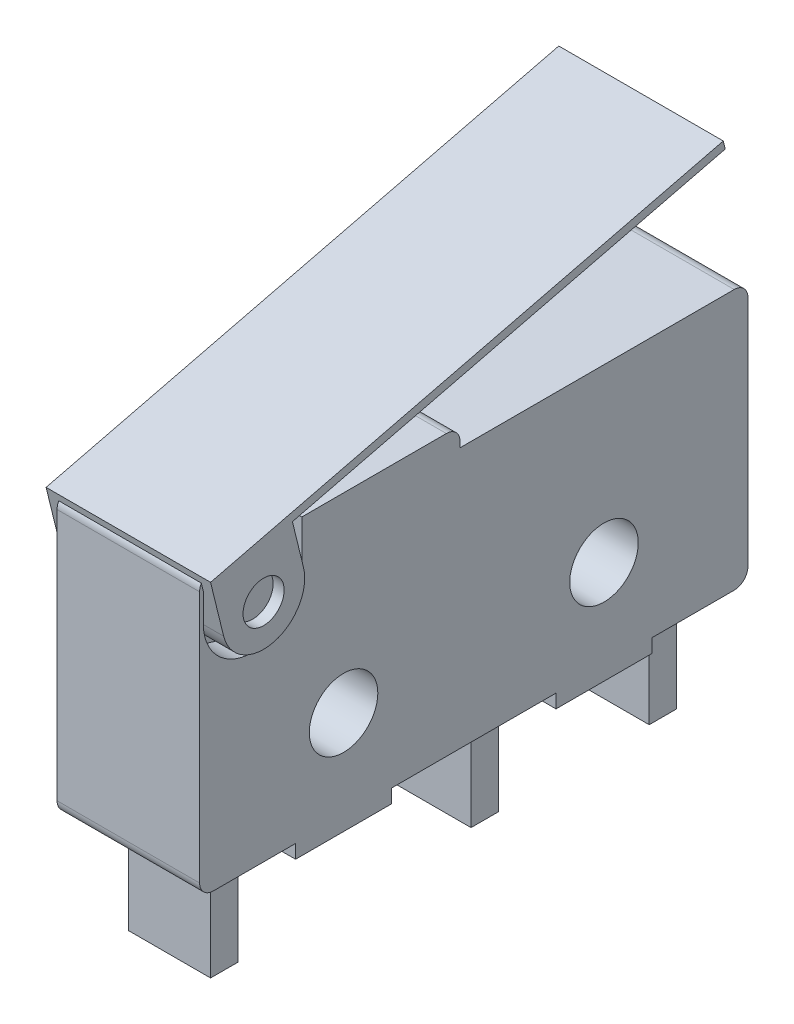
from build123d import *

# Parameters (mm, degrees)
SKETCH1_R             = 1.25
BOSS_EXTRUDE1_DEPTH   = 2.6
SKETCH2_W             = 1
SKETCH2_H             = 3.8
BOSS_EXTRUDE2_DEPTH   = 1.5
BOSS_EXTRUDE2_2_DEPTH = 1.5
BOSS_EXTRUDE2_3_DEPTH = 1.5
FILLET1_R             = 0.5
SKETCH3_R             = 0.75
BOSS_EXTRUDE3_DEPTH   = 3
SKETCH4_R             = 0.75
CUT_EXTRUDE1_DEPTH    = 1


with BuildPart() as part:
    # Sketch1 → Boss-Extrude1 (new, symmetric)
    with BuildSketch(Plane(origin=(0, 0, 0), x_dir=(0, 0, -1), z_dir=(1, 0, 0))):
        Polygon((9.5, 10.2), (9.5, 9.5), (20, 9.5), (20, 0), (16.5, 0), (16.5, -0.5), (13, -0.5), (13, 0), (7, 0), (7, -0.5), (3.5, -0.5), (3.5, 0), (0, 0), (0, 10.2), align=None)
        with Locations((5.25, 3.25)):
            Circle(SKETCH1_R, mode=Mode.SUBTRACT)
        with Locations((14.75, 3.25)):
            Circle(SKETCH1_R, mode=Mode.SUBTRACT)
    extrude(amount=BOSS_EXTRUDE1_DEPTH, both=True)

    # Fillet1
    fillet1_edges = [part.edges().sort_by_distance(p)[0] for p in [
        (0, 10.2, 0),
        (0, 10.2, -9.5),
        (0, 9.5, -20),
        (0, 0, -20),
        (0, 0, 0),
    ]]
    fillet(fillet1_edges, radius=FILLET1_R)

    # Sketch4 → Cut-Extrude1 (cut)
    with BuildSketch(Plane(origin=(2.6, 0, 0), x_dir=(0, 0, -1), z_dir=(1, 0, 0))):
        with BuildLine():
            Line((0.136036049, 8.615333379), (0.136036049, 12.621305862))
            ThreePointArc((0.136036049, 12.621305862), (1.93360588, 14.418875693), (3.731175711, 12.621305862))
            Line((3.731175711, 12.621305862), (3.731175711, 8.615333379))
            ThreePointArc((3.731175711, 8.615333379), (1.93360588, 6.817763548), (0.136036049, 8.615333379))
        make_face()
        with Locations((1.93360588, 8.615333379)):
            Circle(SKETCH4_R, mode=Mode.SUBTRACT)
    cut_extrude1 = extrude(amount=-CUT_EXTRUDE1_DEPTH, mode=Mode.SUBTRACT)

    # Mirror2: Cut-Extrude1 across plane
    add(cut_extrude1.mirror(Plane(origin=(0, 0, 0), x_dir=(0, 0, 1), z_dir=(1, 0, 0))), mode=Mode.SUBTRACT)


with BuildPart() as body_2:
    # Sketch2 → Boss-Extrude2 (new, symmetric)
    with BuildSketch(Plane(origin=(0, 0, 0), x_dir=(0, 0, -1), z_dir=(1, 0, 0))):
        with Locations((2, -1.9)):
            Rectangle(SKETCH2_W, SKETCH2_H)
    extrude(amount=BOSS_EXTRUDE2_DEPTH, both=True)


with BuildPart() as body_3:
    # Sketch2 → Boss-Extrude2 2 (new, symmetric)
    with BuildSketch(Plane(origin=(0, 0, 0), x_dir=(0, 0, -1), z_dir=(1, 0, 0))):
        with Locations((11.5, -1.9)):
            Rectangle(SKETCH2_W, SKETCH2_H)
    extrude(amount=BOSS_EXTRUDE2_2_DEPTH, both=True)


with BuildPart() as body_4:
    # Sketch2 → Boss-Extrude2 3 (new, symmetric)
    with BuildSketch(Plane(origin=(0, 0, 0), x_dir=(0, 0, -1), z_dir=(1, 0, 0))):
        with Locations((18, -1.9)):
            Rectangle(SKETCH2_W, SKETCH2_H)
    extrude(amount=BOSS_EXTRUDE2_3_DEPTH, both=True)


with BuildPart() as body_5:
    # Sketch3 → Boss-Extrude3 (new, symmetric)
    with BuildSketch(Plane(origin=(0, 0, 0), x_dir=(0, 0, -1), z_dir=(1, 0, 0))):
        with BuildLine():
            Line((0.476867785, 8.25768254), (0, 10.2))
            Line((0, 10.2), (18.700895569, 14.791347619))
            Line((18.700895569, 14.791347619), (18.772425737, 14.5))
            Line((18.772425737, 14.5), (2.985006358, 10.623954058))
            Line((2.985006358, 10.623954058), (3.390343975, 8.972984217))
            ThreePointArc((3.390343975, 8.972984217), (2.291256719, 7.158595284), (0.476867785, 8.25768254))
        make_face()
        with Locations((1.93360588, 8.615333379)):
            Circle(SKETCH3_R, mode=Mode.SUBTRACT)
    extrude(amount=BOSS_EXTRUDE3_DEPTH, both=True)


solid = Compound([part.part, body_2.part, body_3.part, body_4.part, body_5.part])
